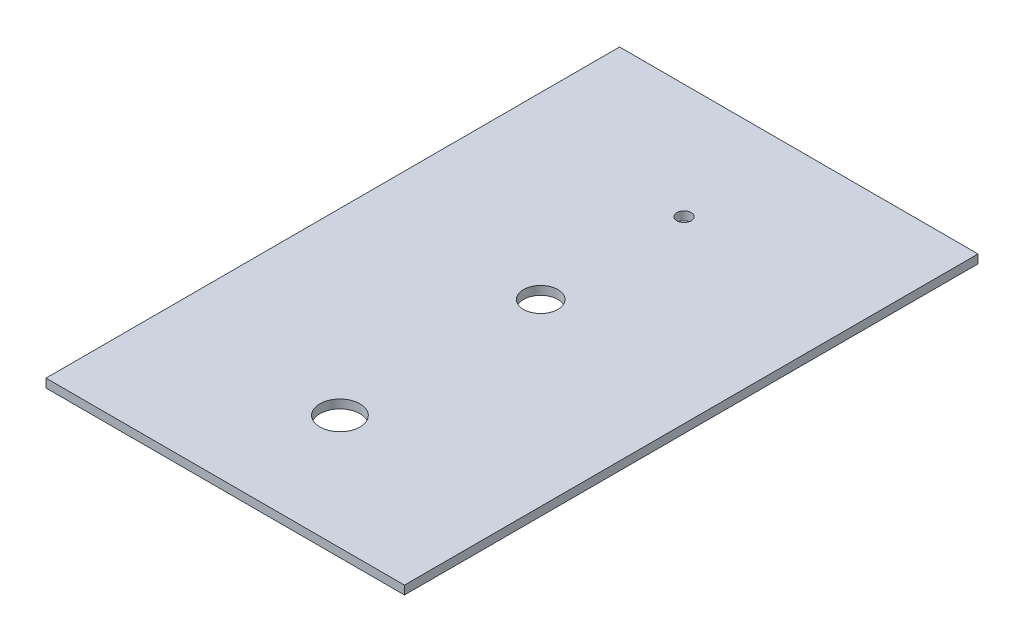
from build123d import *

# Parameters (mm, degrees)
SKETCH1_W           = 125
SKETCH1_H           = 200
BOSS_EXTRUDE1_DEPTH = 3
SKETCH2_R           = 2.5
SKETCH2_R_2         = 7
SKETCH2_R_3         = 6
CUT_EXTRUDE1_DEPTH  = 3


with BuildPart() as part:
    # Sketch1 → Boss-Extrude1 (new body)
    with BuildSketch(Plane(origin=(0, 0, 0), x_dir=(1, 0, 0), z_dir=(0, 1, 0))):
        Rectangle(SKETCH1_W, SKETCH1_H)
    extrude(amount=BOSS_EXTRUDE1_DEPTH)

    # Sketch2 → Cut-Extrude1 (cut)
    with BuildSketch(Plane(origin=(0, 3, 0), x_dir=(1, 0, 0), z_dir=(0, 1, 0))):
        with Locations(Location((0, 60, 0), (0, 0, 270))):
            Circle(SKETCH2_R)
        with Locations(Location((0, -60, 0), (0, 0, 270))):
            Circle(SKETCH2_R_2)
        with Locations(Location((0, 10, 0), (0, 0, 270))):
            Circle(SKETCH2_R_3)
    extrude(amount=-CUT_EXTRUDE1_DEPTH, mode=Mode.SUBTRACT)


solid = part.part
